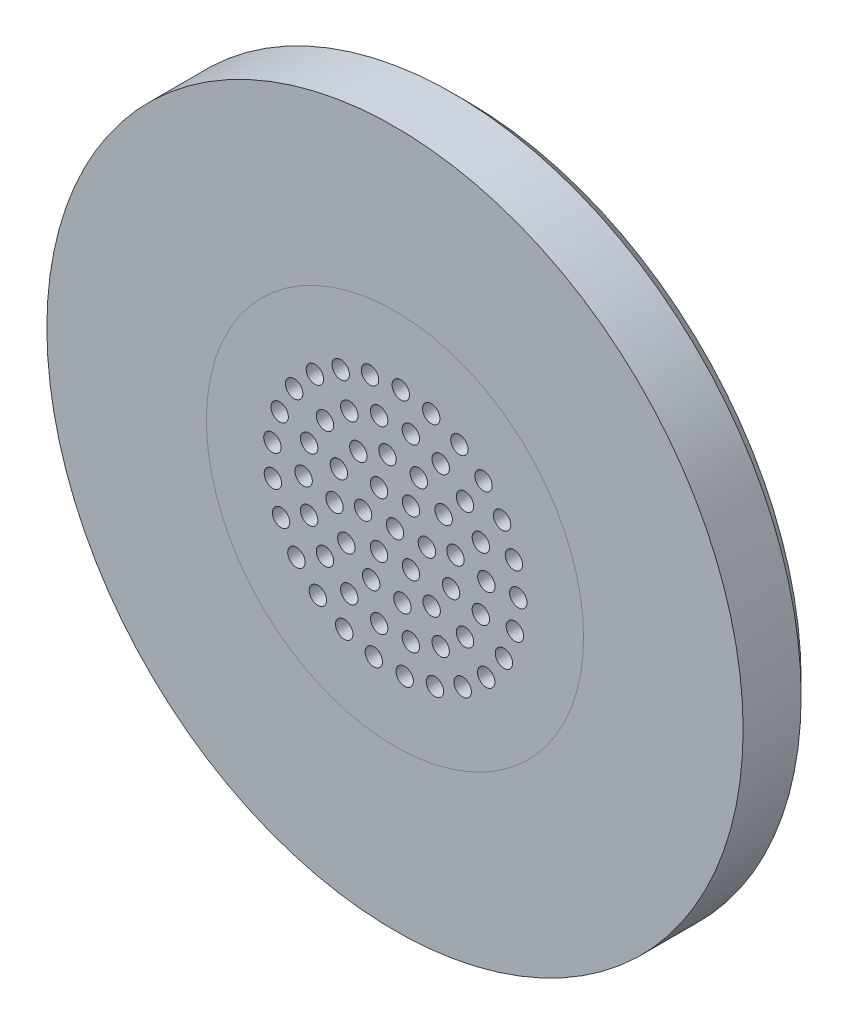
from build123d import *

# Parameters (mm, degrees)
SCHIZZO1_R                   = 24
SCHIZZO1_R_2                 = 0.6
ESTRUSIONE_ESTRUSIONE1_DEPTH = 5
SMUSSO1_SIZE                 = 1


with BuildPart() as part:
    # Schizzo1 → Estrusione-Estrusione1 (new body)
    with BuildSketch(Plane.XY):
        Circle(SCHIZZO1_R)
        with Locations((-2.2, 0)):
            Circle(SCHIZZO1_R_2, mode=Mode.SUBTRACT)
        Circle(SCHIZZO1_R_2, mode=Mode.SUBTRACT)
        with Locations((-3.866120385, 1.64107074)):
            Circle(SCHIZZO1_R_2, mode=Mode.SUBTRACT)
        with Locations((-1.1, 1.905255888)):
            Circle(SCHIZZO1_R_2, mode=Mode.SUBTRACT)
        with Locations((1.1, 1.905255888)):
            Circle(SCHIZZO1_R_2, mode=Mode.SUBTRACT)
        with Locations((2.2, 0)):
            Circle(SCHIZZO1_R_2, mode=Mode.SUBTRACT)
        with Locations((1.1, -1.905255888)):
            Circle(SCHIZZO1_R_2, mode=Mode.SUBTRACT)
        with Locations((-1.1, -1.905255888)):
            Circle(SCHIZZO1_R_2, mode=Mode.SUBTRACT)
        with Locations((-2.527623097, 3.354269142)):
            Circle(SCHIZZO1_R_2, mode=Mode.SUBTRACT)
        with Locations((-0.511851242, 4.168693837)):
            Circle(SCHIZZO1_R_2, mode=Mode.SUBTRACT)
        with Locations((1.64107074, 3.866120385)):
            Circle(SCHIZZO1_R_2, mode=Mode.SUBTRACT)
        with Locations((3.354269142, 2.527623097)):
            Circle(SCHIZZO1_R_2, mode=Mode.SUBTRACT)
        with Locations((4.168693837, 0.511851242)):
            Circle(SCHIZZO1_R_2, mode=Mode.SUBTRACT)
        with Locations((3.866120385, -1.64107074)):
            Circle(SCHIZZO1_R_2, mode=Mode.SUBTRACT)
        with Locations((2.527623097, -3.354269142)):
            Circle(SCHIZZO1_R_2, mode=Mode.SUBTRACT)
        with Locations((0.511851242, -4.168693837)):
            Circle(SCHIZZO1_R_2, mode=Mode.SUBTRACT)
        with Locations((-1.64107074, -3.866120385)):
            Circle(SCHIZZO1_R_2, mode=Mode.SUBTRACT)
        with Locations((-3.354269142, -2.527623097)):
            Circle(SCHIZZO1_R_2, mode=Mode.SUBTRACT)
        with Locations((-4.168693837, -0.511851242)):
            Circle(SCHIZZO1_R_2, mode=Mode.SUBTRACT)
        with Locations((-6.3, 0)):
            Circle(SCHIZZO1_R_2, mode=Mode.SUBTRACT)
        with Locations((-5.920063511, 2.154726903)):
            Circle(SCHIZZO1_R_2, mode=Mode.SUBTRACT)
        with Locations((-4.826079992, 4.049561941)):
            Circle(SCHIZZO1_R_2, mode=Mode.SUBTRACT)
        with Locations((-3.15, 5.455960044)):
            Circle(SCHIZZO1_R_2, mode=Mode.SUBTRACT)
        with Locations((-1.093983519, 6.204288844)):
            Circle(SCHIZZO1_R_2, mode=Mode.SUBTRACT)
        with Locations((1.093983519, 6.204288844)):
            Circle(SCHIZZO1_R_2, mode=Mode.SUBTRACT)
        with Locations((3.15, 5.455960044)):
            Circle(SCHIZZO1_R_2, mode=Mode.SUBTRACT)
        with Locations((4.826079992, 4.049561941)):
            Circle(SCHIZZO1_R_2, mode=Mode.SUBTRACT)
        with Locations((5.920063511, 2.154726903)):
            Circle(SCHIZZO1_R_2, mode=Mode.SUBTRACT)
        with Locations((6.3, 0)):
            Circle(SCHIZZO1_R_2, mode=Mode.SUBTRACT)
        with Locations((5.920063511, -2.154726903)):
            Circle(SCHIZZO1_R_2, mode=Mode.SUBTRACT)
        with Locations((4.826079992, -4.049561941)):
            Circle(SCHIZZO1_R_2, mode=Mode.SUBTRACT)
        with Locations((3.15, -5.455960044)):
            Circle(SCHIZZO1_R_2, mode=Mode.SUBTRACT)
        with Locations((1.093983519, -6.204288844)):
            Circle(SCHIZZO1_R_2, mode=Mode.SUBTRACT)
        with Locations((-1.093983519, -6.204288844)):
            Circle(SCHIZZO1_R_2, mode=Mode.SUBTRACT)
        with Locations((-3.15, -5.455960044)):
            Circle(SCHIZZO1_R_2, mode=Mode.SUBTRACT)
        with Locations((-4.826079992, -4.049561941)):
            Circle(SCHIZZO1_R_2, mode=Mode.SUBTRACT)
        with Locations((-5.920063511, -2.154726903)):
            Circle(SCHIZZO1_R_2, mode=Mode.SUBTRACT)
        with Locations((-8.448689608, 0.932547001)):
            Circle(SCHIZZO1_R_2, mode=Mode.SUBTRACT)
        with Locations((-7.951343479, 3.004352988)):
            Circle(SCHIZZO1_R_2, mode=Mode.SUBTRACT)
        with Locations((-6.954385197, 4.887384427)):
            Circle(SCHIZZO1_R_2, mode=Mode.SUBTRACT)
        with Locations((-5.520457316, 6.463323528)):
            Circle(SCHIZZO1_R_2, mode=Mode.SUBTRACT)
        with Locations((-3.739658799, 7.633148241)):
            Circle(SCHIZZO1_R_2, mode=Mode.SUBTRACT)
        with Locations((-1.723883767, 8.323354177)):
            Circle(SCHIZZO1_R_2, mode=Mode.SUBTRACT)
        with Locations((0.400209223, 8.49057316)):
            Circle(SCHIZZO1_R_2, mode=Mode.SUBTRACT)
        with Locations((2.499155596, 8.124298204)):
            Circle(SCHIZZO1_R_2, mode=Mode.SUBTRACT)
        with Locations((4.441070831, 7.247543713)):
            Circle(SCHIZZO1_R_2, mode=Mode.SUBTRACT)
        with Locations((6.103937252, 5.915399397)):
            Circle(SCHIZZO1_R_2, mode=Mode.SUBTRACT)
        with Locations((7.383270847, 4.21156878)):
            Circle(SCHIZZO1_R_2, mode=Mode.SUBTRACT)
        with Locations((8.198686382, 2.243109809)):
            Circle(SCHIZZO1_R_2, mode=Mode.SUBTRACT)
        with Locations((8.498948298, 0.133707998)):
            Circle(SCHIZZO1_R_2, mode=Mode.SUBTRACT)
        with Locations((8.265190036, -1.984095178)):
            Circle(SCHIZZO1_R_2, mode=Mode.SUBTRACT)
        with Locations((7.512099486, -3.977230357)):
            Circle(SCHIZZO1_R_2, mode=Mode.SUBTRACT)
        with Locations((6.286996098, -5.720461525)):
            Circle(SCHIZZO1_R_2, mode=Mode.SUBTRACT)
        with Locations((4.666857624, -7.104255057)):
            Circle(SCHIZZO1_R_2, mode=Mode.SUBTRACT)
        with Locations((2.753483321, -8.041662117)):
            Circle(SCHIZZO1_R_2, mode=Mode.SUBTRACT)
        with Locations((0.667097535, -8.47378197)):
            Circle(SCHIZZO1_R_2, mode=Mode.SUBTRACT)
        with Locations((-1.461204443, -8.373462938)):
            Circle(SCHIZZO1_R_2, mode=Mode.SUBTRACT)
        with Locations((-3.497693572, -7.747008434)):
            Circle(SCHIZZO1_R_2, mode=Mode.SUBTRACT)
        with Locations((-5.31440975, -6.633780899)):
            Circle(SCHIZZO1_R_2, mode=Mode.SUBTRACT)
        with Locations((-6.797202018, -5.103728512)):
            Circle(SCHIZZO1_R_2, mode=Mode.SUBTRACT)
        with Locations((-7.852901085, -3.252990093)):
            Circle(SCHIZZO1_R_2, mode=Mode.SUBTRACT)
        with Locations((-8.415173496, -1.197854343)):
            Circle(SCHIZZO1_R_2, mode=Mode.SUBTRACT)
    extrude(amount=ESTRUSIONE_ESTRUSIONE1_DEPTH)

    # Smusso1
    smusso1_edges = [part.edges().sort_by_distance(p)[0] for p in [
        (-24, 0, 0),
    ]]
    chamfer(smusso1_edges, length=SMUSSO1_SIZE)


solid = part.part
